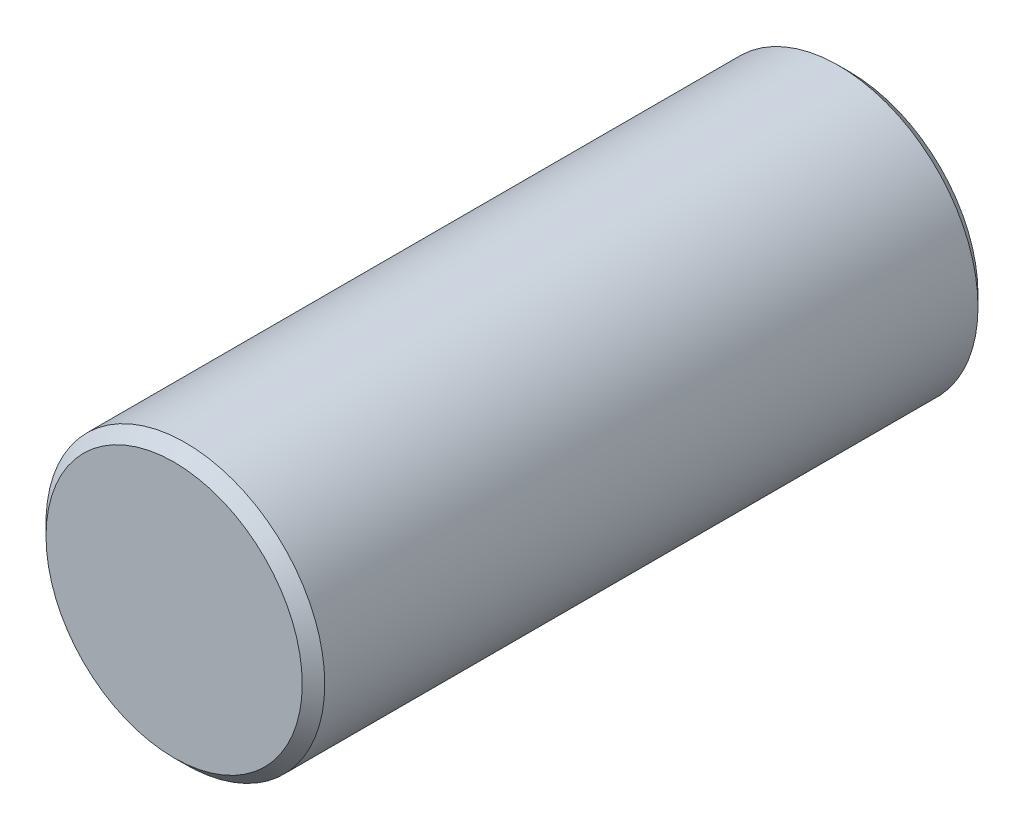
from build123d import *

# Parameters (mm, degrees)
SKETCH_1_R      = 2.475
EXTRUDE_1_DEPTH = 12
CHAMFER_1_SIZE  = 0.2


with BuildPart() as part:
    # 스케치1 → 보스-돌출1 (new body)
    with BuildSketch(Plane.XY):
        Circle(SKETCH_1_R)
    extrude(amount=EXTRUDE_1_DEPTH)

    # 모따기1
    chamfer_1_edges = [part.edges().sort_by_distance(p)[0] for p in [
        (-2.475, 0, 0),
        (-2.475, 0, 12),
    ]]
    chamfer(chamfer_1_edges, length=CHAMFER_1_SIZE)


solid = part.part
